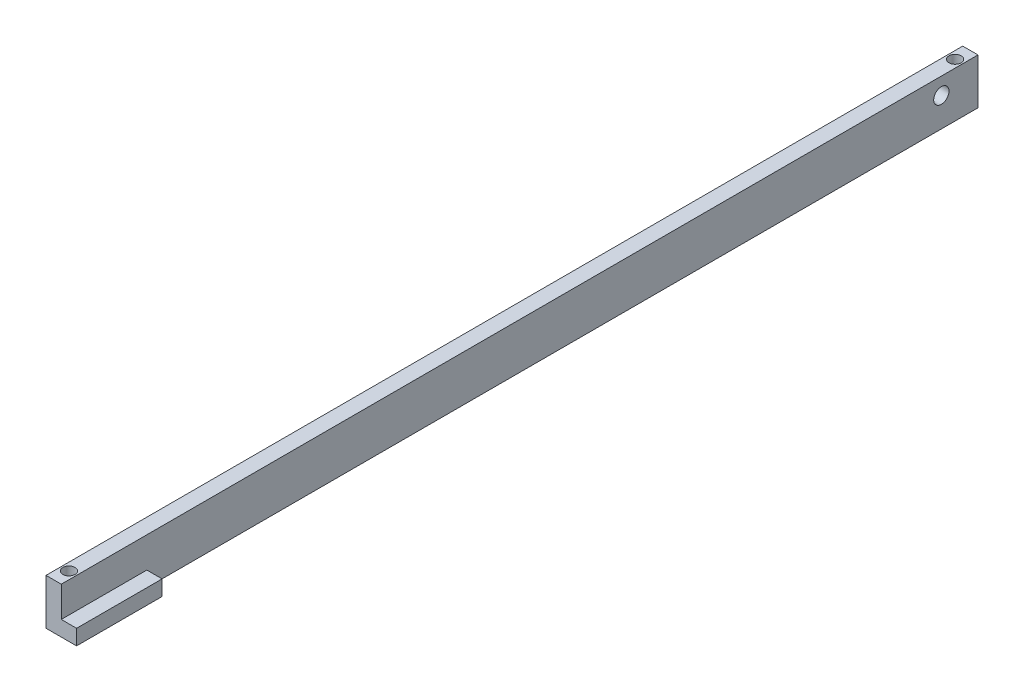
from build123d import *

# Parameters (mm, degrees)
BOSS_EXTRUDE1_DEPTH = 381
CUT_EXTRUDE1_REACH  = 383.687
SKETCH2_R           = 3.175
SKETCH3_R           = 2.54
CUT_EXTRUDE2_DEPTH  = 7.62
CUT_EXTRUDE3_START  = -7.62
SKETCH4_R           = 2.54
CUT_EXTRUDE3_DEPTH  = 7.62
SKETCH5_W           = 6.35
SKETCH5_H           = 6.35
CUT_EXTRUDE4_DEPTH  = 345.44


with BuildPart() as part:
    # Sketch1 → Boss-Extrude1 (new body)
    with BuildSketch(Plane.XY):
        Polygon((0, 0), (-12.7, 0), (-12.7, 19.05), (-6.35, 19.05), (-6.35, 6.35), (0, 6.35), align=None)
    extrude(amount=-BOSS_EXTRUDE1_DEPTH)

    # Sketch2 → Cut-Extrude1 (cut, up to next)
    with BuildSketch(Plane.ZY.offset(12.7), mode=Mode.PRIVATE) as cut_extrude1_sk1:
        with Locations(Location((-365.76, 12.065, 0), (0, 0, 270))):
            Circle(SKETCH2_R)
    cut_extrude1_tool1 = extrude(cut_extrude1_sk1.sketch, amount=-CUT_EXTRUDE1_REACH, mode=Mode.PRIVATE) & part.part
    add(cut_extrude1_tool1.solids().sort_by_distance((-12.7, 12.065, -365.76))[0], mode=Mode.SUBTRACT)

    # Sketch3 → Cut-Extrude2 (cut)
    with BuildSketch(Plane(origin=(0, 19.05, 0), x_dir=(1, 0, 0), z_dir=(0, 1, 0))):
        with Locations(Location((-9.525, 6.35, 0), (0, 0, 270))):
            Circle(SKETCH3_R)
        with Locations(Location((-9.525, 374.65, 0), (0, 0, 270))):
            Circle(SKETCH3_R)
    extrude(amount=-CUT_EXTRUDE2_DEPTH, mode=Mode.SUBTRACT)

    # Sketch4 → Cut-Extrude3 (cut)
    with BuildSketch(Plane.XZ.offset(CUT_EXTRUDE3_START)):
        with Locations(Location((-9.525, -374.65, 0), (0, 0, 90))):
            Circle(SKETCH4_R)
        with Locations(Location((-9.525, -6.35, 0), (0, 0, 90))):
            Circle(SKETCH4_R)
    extrude(amount=CUT_EXTRUDE3_DEPTH, mode=Mode.SUBTRACT)

    # Sketch5 → Cut-Extrude4 (cut)
    with BuildSketch(Plane(origin=(0, 0, -381), x_dir=(-1, 0, 0), z_dir=(0, 0, -1))):
        with Locations((3.175, 3.175)):
            Rectangle(SKETCH5_W, SKETCH5_H)
    extrude(amount=-CUT_EXTRUDE4_DEPTH, mode=Mode.SUBTRACT)


solid = part.part
